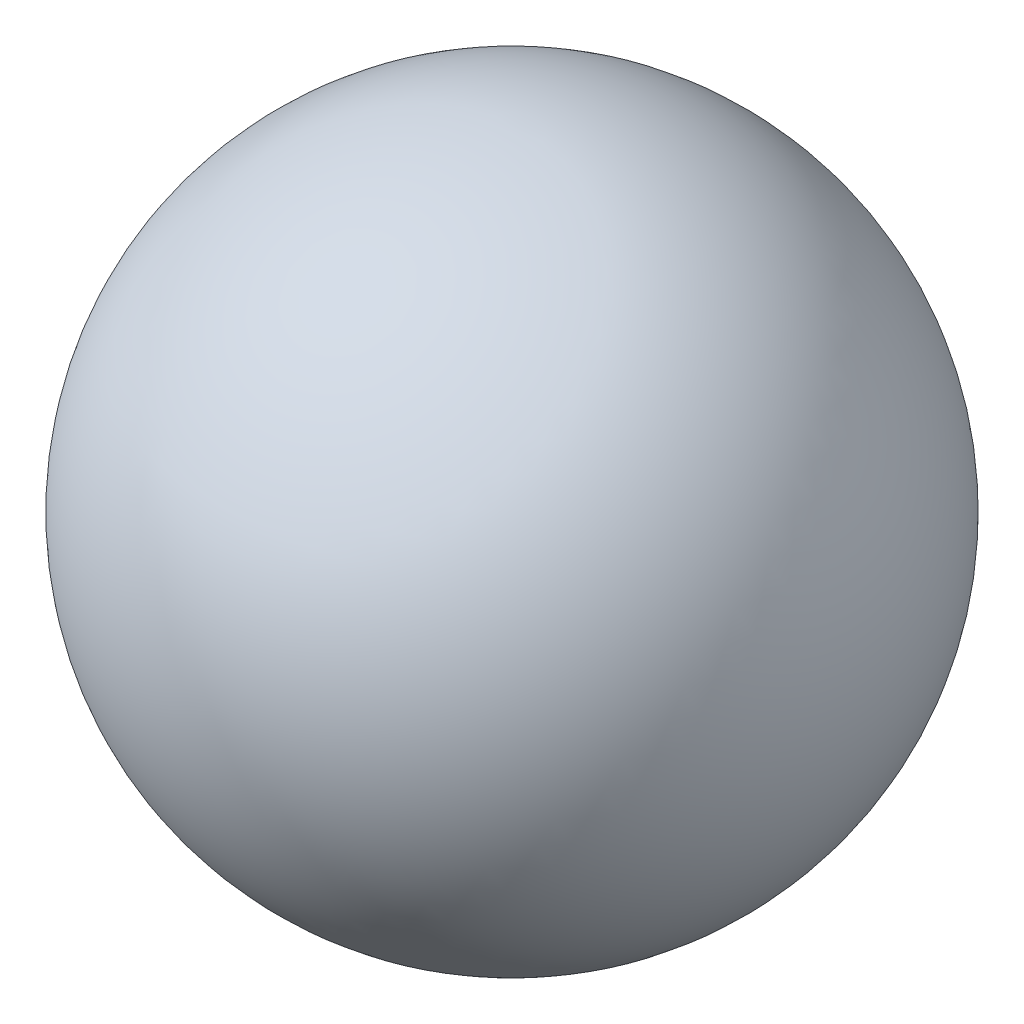
from build123d import *


with BuildPart() as part:
    # Sketch1 → Revolve1 (revolve)
    with BuildSketch(Plane(origin=(0, 0, 0), x_dir=(0, 0, -1), z_dir=(1, 0, 0))):
        with BuildLine():
            Line((0, 18.415), (0, -18.415))
            ThreePointArc((0, -18.415), (18.415, 0), (0, 18.415))
        make_face()
    revolve(axis=Axis((0, 18.415, 0), (0, -1, 0)))


solid = part.part
